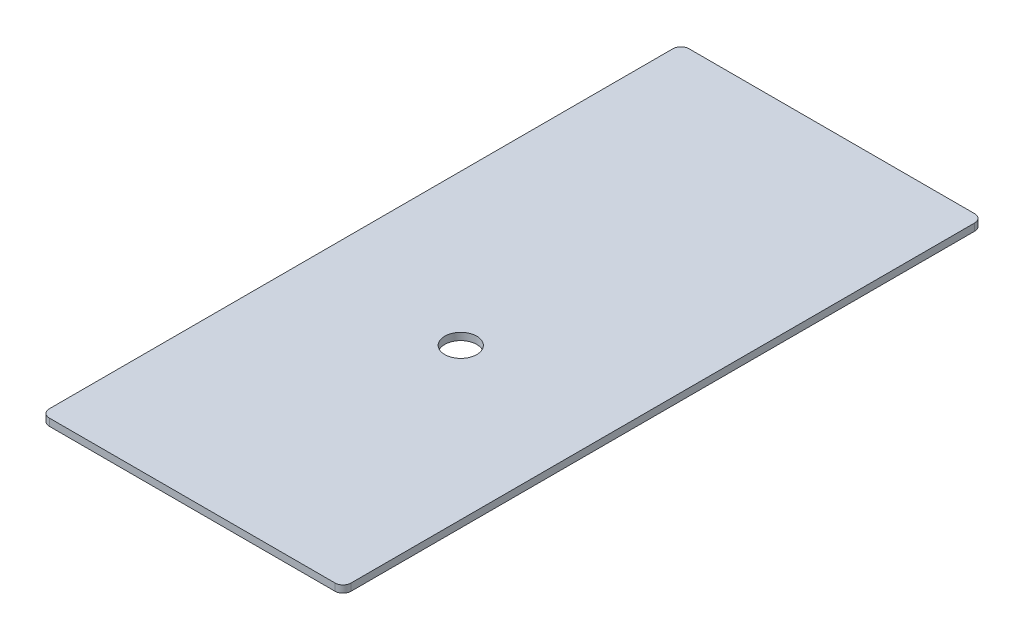
from build123d import *

# Parameters (mm, degrees)
SKETCH1_W           = 188.7
SKETCH1_H           = 400
BOSS_EXTRUDE1_DEPTH = 4.5
FILLET1_R           = 5
SKETCH3_R           = 10
CUT_EXTRUDE2_DEPTH  = 20


with BuildPart() as part:
    # Sketch1 → Boss-Extrude1 (new body)
    with BuildSketch(Plane(origin=(0, 0, 0), x_dir=(1, 0, 0), z_dir=(0, 1, 0))):
        with Locations((94.35, 200)):
            Rectangle(SKETCH1_W, SKETCH1_H)
    extrude(amount=BOSS_EXTRUDE1_DEPTH)

    # Fillet1
    fillet1_edges = [part.edges().sort_by_distance(p)[0] for p in [
        (0, 2.25, -400),
        (188.7, 2.25, -400),
        (188.7, 2.25, 0),
        (0, 2.25, 0),
    ]]
    fillet(fillet1_edges, radius=FILLET1_R)

    # Sketch3 → Cut-Extrude2 (cut)
    with BuildSketch(Plane(origin=(0, 4.5, 0), x_dir=(1, 0, 0), z_dir=(0, 1, 0))):
        with Locations(Location((94.306601718, 168, 0), (0, 0, 270))):
            Circle(SKETCH3_R)
    extrude(amount=-CUT_EXTRUDE2_DEPTH, mode=Mode.SUBTRACT)


solid = part.part
